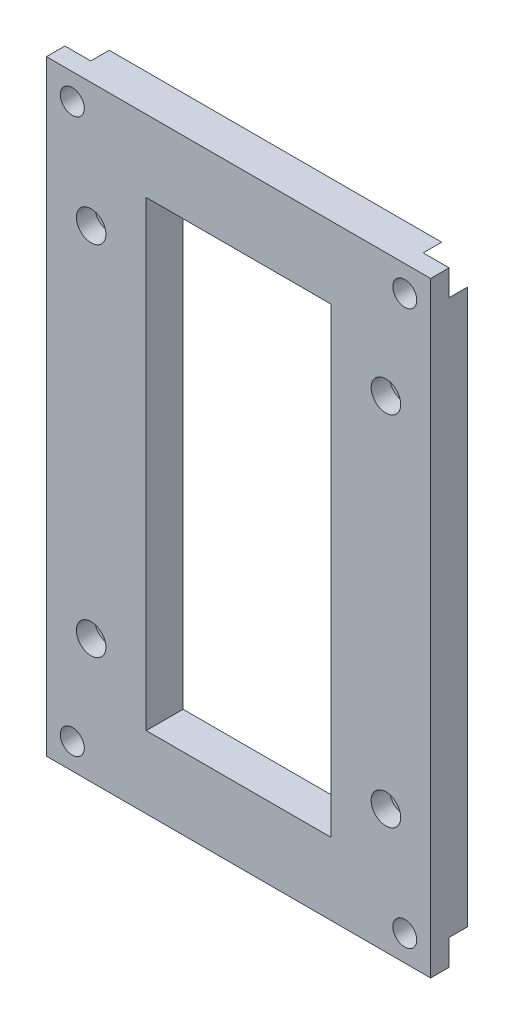
from build123d import *

# Parameters (mm, degrees)
SKETCH1_W           = 104
SKETCH1_H           = 164
SKETCH1_R           = 3.25
BOSS_EXTRUDE1_DEPTH = 10
SKETCH2_R           = 1.625
CUT_EXTRUDE1_DEPTH  = 10
SKETCH3_R           = 4
CUT_EXTRUDE2_DEPTH  = 5
SKETCH5_R           = 7
SKETCH5_R_2         = 3.25
CUT_EXTRUDE3_DEPTH  = 5
SKETCH6_W           = 50
SKETCH6_H           = 125
CUT_EXTRUDE4_DEPTH  = 52


with BuildPart() as part:
    # Sketch1 → Boss-Extrude1 (new body)
    with BuildSketch(Plane.XY):
        Rectangle(SKETCH1_W, SKETCH1_H)
        with Locations((-45, 75)):
            Circle(SKETCH1_R, mode=Mode.SUBTRACT)
        with Locations((45, 75)):
            Circle(SKETCH1_R, mode=Mode.SUBTRACT)
        with Locations((-45, -75)):
            Circle(SKETCH1_R, mode=Mode.SUBTRACT)
        with Locations((45, -75)):
            Circle(SKETCH1_R, mode=Mode.SUBTRACT)
    extrude(amount=BOSS_EXTRUDE1_DEPTH)

    # Sketch2 → Cut-Extrude1 (cut)
    with BuildSketch(Plane(origin=(0, 0, 0), x_dir=(-1, 0, 0), z_dir=(0, 0, -1))):
        with Locations((-39.9, 48.4)):
            Circle(SKETCH2_R)
        with Locations((39.9, 48.4)):
            Circle(SKETCH2_R)
        with Locations((-39.9, -48.4)):
            Circle(SKETCH2_R)
        with Locations((39.9, -48.4)):
            Circle(SKETCH2_R)
    extrude(amount=-CUT_EXTRUDE1_DEPTH, mode=Mode.SUBTRACT)

    # Sketch3 → Cut-Extrude2 (cut)
    with BuildSketch(Plane.XY.offset(10)):
        with Locations((-39.9, 48.4)):
            Circle(SKETCH3_R)
        with Locations((39.9, 48.4)):
            Circle(SKETCH3_R)
        with Locations((-39.9, -48.4)):
            Circle(SKETCH3_R)
        with Locations((39.9, -48.4)):
            Circle(SKETCH3_R)
    extrude(amount=-CUT_EXTRUDE2_DEPTH, mode=Mode.SUBTRACT)

    # Sketch5 → Cut-Extrude3 (cut)
    # profile 1 of 8: a face of its own
    with BuildSketch(Plane(origin=(0, 0, 0), x_dir=(-1, 0, 0), z_dir=(0, 0, -1))):
        with Locations((-45, 75)):
            Circle(SKETCH5_R)
        with Locations((-45, 75)):
            Circle(SKETCH5_R_2, mode=Mode.SUBTRACT)
    # profile 2 of 8: a face of its own
    with BuildSketch(Plane(origin=(0, 0, 0), x_dir=(-1, 0, 0), z_dir=(0, 0, -1))):
        with BuildLine():
            Line((-44.999999978, 82), (-52, 82))
            Line((-52, 82), (-52, 75))
            ThreePointArc((-52, 75), (-49.94974746, 79.949747476), (-44.999999978, 82))
        make_face()
    # profile 3 of 8: a face of its own
    with BuildSketch(Plane(origin=(0, 0, 0), x_dir=(-1, 0, 0), z_dir=(0, 0, -1))):
        with Locations((45, 75)):
            Circle(SKETCH5_R)
        with Locations((45, 75)):
            Circle(SKETCH5_R_2, mode=Mode.SUBTRACT)
    # profile 4 of 8: a face of its own
    with BuildSketch(Plane(origin=(0, 0, 0), x_dir=(-1, 0, 0), z_dir=(0, 0, -1))):
        with BuildLine():
            Line((52, 82), (45, 82))
            ThreePointArc((45, 82), (49.949747468, 79.949747468), (52, 75))
            Line((52, 75), (52, 82))
        make_face()
    # profile 5 of 8: a face of its own
    with BuildSketch(Plane(origin=(0, 0, 0), x_dir=(-1, 0, 0), z_dir=(0, 0, -1))):
        with Locations((-45, -75)):
            Circle(SKETCH5_R)
        with Locations((-45, -75)):
            Circle(SKETCH5_R_2, mode=Mode.SUBTRACT)
    # profile 6 of 8: a face of its own
    with BuildSketch(Plane(origin=(0, 0, 0), x_dir=(-1, 0, 0), z_dir=(0, 0, -1))):
        with Locations((45, -75)):
            Circle(SKETCH5_R)
        with Locations((45, -75)):
            Circle(SKETCH5_R_2, mode=Mode.SUBTRACT)
    # profile 7 of 8: a face of its own
    with BuildSketch(Plane(origin=(0, 0, 0), x_dir=(-1, 0, 0), z_dir=(0, 0, -1))):
        with BuildLine():
            Line((52, -82), (52, -75))
            ThreePointArc((52, -75), (49.949747468, -79.949747468), (45, -82))
            Line((45, -82), (52, -82))
        make_face()
    # profile 8 of 8: a face of its own
    with BuildSketch(Plane(origin=(0, 0, 0), x_dir=(-1, 0, 0), z_dir=(0, 0, -1))):
        with BuildLine():
            ThreePointArc((-45, -82), (-49.949747468, -79.949747468), (-52, -75))
            Line((-52, -75), (-52, -82))
            Line((-52, -82), (-45, -82))
        make_face()
    extrude(amount=-CUT_EXTRUDE3_DEPTH, mode=Mode.SUBTRACT)

    # Sketch6 → Cut-Extrude4 (cut)
    with BuildSketch(Plane(origin=(0, 0, 0), x_dir=(-1, 0, 0), z_dir=(0, 0, -1))):
        Rectangle(SKETCH6_W, SKETCH6_H)
    extrude(amount=-CUT_EXTRUDE4_DEPTH, mode=Mode.SUBTRACT)


solid = part.part
